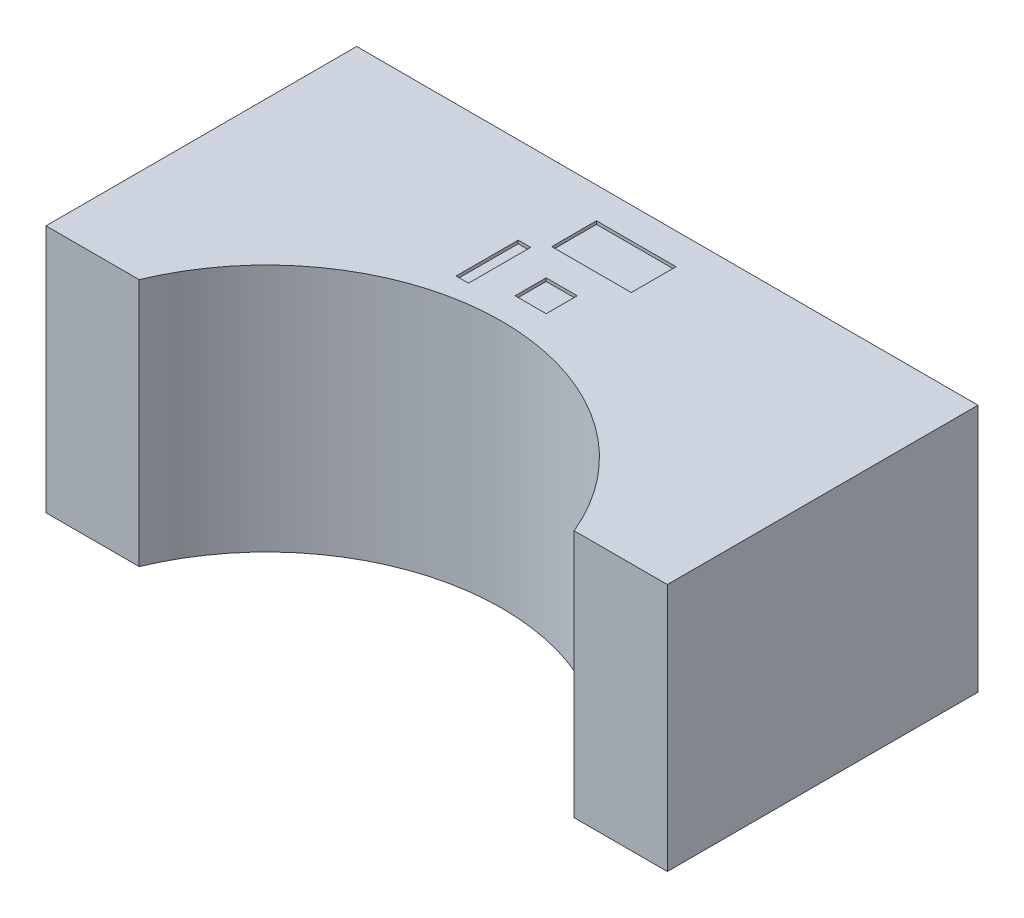
from build123d import *

# Parameters (mm, degrees)
EXTRUDE_1_DEPTH     = 400
SKETCH_2_W          = 128
SKETCH_2_H          = 72
CUT_EXTRUDE_1_DEPTH = 5
SKETCH_3_W          = 50
SKETCH_3_H          = 50
CUT_EXTRUDE_3_DEPTH = 5
SKETCH_4_W          = 20
SKETCH_4_H          = 100
CUT_EXTRUDE_4_DEPTH = 5


with BuildPart() as part:
    # 草图1 → 凸台-拉伸1 (new body)
    with BuildSketch(Plane(origin=(0, 0, 0), x_dir=(1, 0, 0), z_dir=(0, 1, 0))):
        with BuildLine():
            Line((0, 0), (500, 0))
            Line((500, 0), (500, -500))
            Line((500, -500), (350, -500))
            ThreePointArc((350, -500), (0, -266.137476728), (-350, -500))
            Line((-350, -500), (-500, -500))
            Line((-500, -500), (-500, 0))
            Line((-500, 0), (0, 0))
        make_face()
    extrude(amount=EXTRUDE_1_DEPTH)

    # 草图2 → 切除-拉伸1 (cut)
    with BuildSketch(Plane(origin=(0, 400, 0), x_dir=(1, 0, 0), z_dir=(0, 1, 0))):
        with Locations((0, -86)):
            Rectangle(SKETCH_2_W, SKETCH_2_H)
    extrude(amount=-CUT_EXTRUDE_1_DEPTH, mode=Mode.SUBTRACT)

    # 草图3 → 切除-拉伸3 (cut)
    with BuildSketch(Plane(origin=(0, 400, 0), x_dir=(1, 0, 0), z_dir=(0, 1, 0))):
        with Locations((0, -195)):
            Rectangle(SKETCH_3_W, SKETCH_3_H)
    extrude(amount=-CUT_EXTRUDE_3_DEPTH, mode=Mode.SUBTRACT)

    # 草图4 → 切除-拉伸4 (cut)
    with BuildSketch(Plane(origin=(0, 400, 0), x_dir=(1, 0, 0), z_dir=(0, 1, 0))):
        with Locations((-90, -190)):
            Rectangle(SKETCH_4_W, SKETCH_4_H)
    extrude(amount=-CUT_EXTRUDE_4_DEPTH, mode=Mode.SUBTRACT)


solid = part.part
